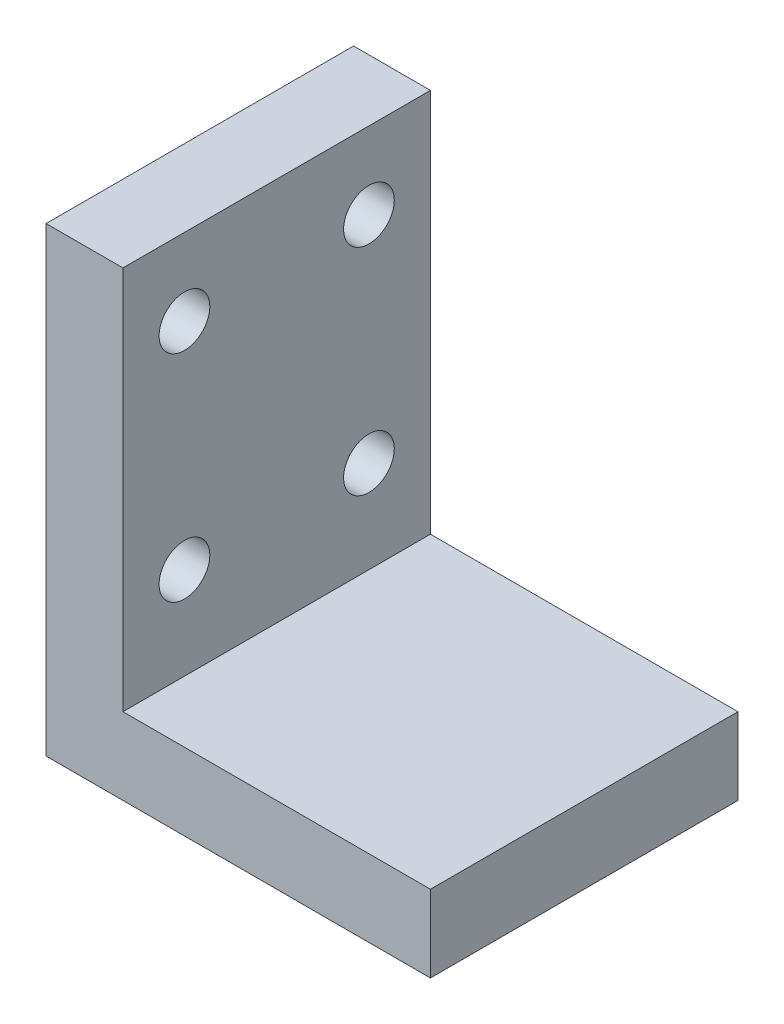
from build123d import *

# Parameters (mm, degrees)
EXTRUDE_1_DEPTH     = 20
SKETCH_2_R          = 1.65
CUT_EXTRUDE_1_DEPTH = 20


with BuildPart() as part:
    # 草图1 → 凸台-拉伸1 (new body)
    with BuildSketch(Plane.XY):
        Polygon((0, 30), (0, 0), (25, 0), (25, 5), (5, 5), (5, 30), align=None)
    extrude(amount=EXTRUDE_1_DEPTH)

    # 草图2 → 切除-拉伸1 (cut)
    with BuildSketch(Plane(origin=(5, 0, 0), x_dir=(0, 0, -1), z_dir=(1, 0, 0))):
        with Locations((-16, 25)):
            Circle(SKETCH_2_R)
        with Locations((-4, 25)):
            Circle(SKETCH_2_R)
        with Locations((-4, 11)):
            Circle(SKETCH_2_R)
        with Locations((-16, 11)):
            Circle(SKETCH_2_R)
    extrude(amount=-CUT_EXTRUDE_1_DEPTH, mode=Mode.SUBTRACT)


solid = part.part
